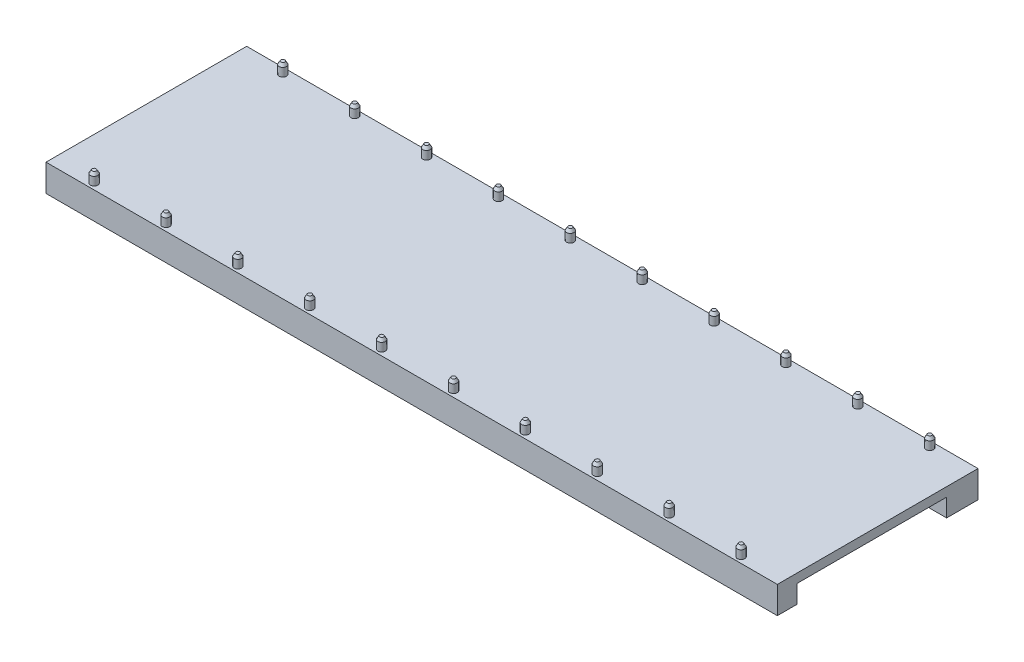
from build123d import *
from OCP.BRepFilletAPI import BRepFilletAPI_MakeChamfer

# Parameters (mm, degrees)
SKETCH1_W                   = 488.315
SKETCH1_H                   = 133.985
BOSS_EXTRUDE1_DEPTH         = 6.0452
SKETCH2_R                   = 2.4765
BOSS_EXTRUDE2_DEPTH         = 7.62
CHAMFER1_SIZE               = 2.032
CHAMFER1_SIZE2              = 1.173175747
LPATTERN1_COUNT             = 5
LPATTERN1_PITCH             = 95.9866
CHAMFER1_OF_LPATTERN1_SIZE  = 2.032
CHAMFER1_OF_LPATTERN1_SIZE2 = 1.173175747
SKETCH3_W                   = 20.955
SKETCH3_H                   = 12.065
SKETCH3_W_2                 = 13.0048
BOSS_EXTRUDE3_DEPTH         = 488.315


with BuildPart() as part:
    # Sketch1 → Boss-Extrude1 (new body)
    with BuildSketch(Plane(origin=(0, 0, 0), x_dir=(1, 0, 0), z_dir=(0, 1, 0))):
        with Locations((244.1575, -66.9925)):
            Rectangle(SKETCH1_W, SKETCH1_H)
    extrude(amount=-BOSS_EXTRUDE1_DEPTH)

    # Sketch2 → Boss-Extrude2 (add)
    with BuildSketch(Plane(origin=(0, 0, 0), x_dir=(1, 0, 0), z_dir=(0, 1, 0))):
        with Locations(Location((28.1305, -4.0005, 0), (0, 0, 90))):
            Circle(SKETCH2_R)
        with Locations(Location((76.1365, -4.0005, 0), (0, 0, 90))):
            Circle(SKETCH2_R)
        with Locations(Location((28.1305, -129.9845, 0), (0, 0, 90))):
            Circle(SKETCH2_R)
        with Locations(Location((76.1365, -129.9845, 0), (0, 0, 90))):
            Circle(SKETCH2_R)
    boss_extrude2 = extrude(amount=BOSS_EXTRUDE2_DEPTH)

    # Chamfer1: one chamfer whose edges measure the first distance from different faces: ONE call of the kernel's chamfer builder (chamfer() names one face for all edges)
    chamfer1_edges_1 = [part.edges().sort_by_distance(p)[0] for p in [
        (28.1305, 7.62, 6.477),
    ]]
    chamfer1_side_1 = [part.faces().sort_by_distance(p)[0] for p in [
        (28.1305, 3.81, 6.477),
    ]]
    chamfer1_edges_2 = [part.edges().sort_by_distance(p)[0] for p in [
        (76.1365, 7.62, 6.477),
    ]]
    chamfer1_side_2 = [part.faces().sort_by_distance(p)[0] for p in [
        (76.1365, 3.81, 6.477),
    ]]
    chamfer1_edges_3 = [part.edges().sort_by_distance(p)[0] for p in [
        (28.1305, 7.62, 132.461),
    ]]
    chamfer1_side_3 = [part.faces().sort_by_distance(p)[0] for p in [
        (28.1305, 3.81, 132.461),
    ]]
    chamfer1_edges_4 = [part.edges().sort_by_distance(p)[0] for p in [
        (76.1365, 7.62, 132.461),
    ]]
    chamfer1_side_4 = [part.faces().sort_by_distance(p)[0] for p in [
        (76.1365, 3.81, 132.461),
    ]]
    chamfer1 = BRepFilletAPI_MakeChamfer(part.part.solid().wrapped)
    for e in chamfer1_edges_1:
        chamfer1.Add(CHAMFER1_SIZE, CHAMFER1_SIZE2, e.wrapped, chamfer1_side_1[0].wrapped)  # the first distance lies on this face
    for e in chamfer1_edges_2:
        chamfer1.Add(CHAMFER1_SIZE, CHAMFER1_SIZE2, e.wrapped, chamfer1_side_2[0].wrapped)  # the first distance lies on this face
    for e in chamfer1_edges_3:
        chamfer1.Add(CHAMFER1_SIZE, CHAMFER1_SIZE2, e.wrapped, chamfer1_side_3[0].wrapped)  # the first distance lies on this face
    for e in chamfer1_edges_4:
        chamfer1.Add(CHAMFER1_SIZE, CHAMFER1_SIZE2, e.wrapped, chamfer1_side_4[0].wrapped)  # the first distance lies on this face
    add(Compound.cast(chamfer1.Shape()), mode=Mode.REPLACE)

    # LPattern1: Boss-Extrude2 ×5
    with Locations(*[(i * LPATTERN1_PITCH, 0, 0) for i in range(1, LPATTERN1_COUNT)]):
        add(boss_extrude2)

    # Chamfer1 of LPattern1: one chamfer whose edges measure the first distance from different faces: ONE call of the kernel's chamfer builder (chamfer() names one face for all edges)
    chamfer1_of_lpattern1_edges_1 = [part.edges().sort_by_distance(p)[0] for p in [
        (124.1171, 7.62, 6.477),
    ]]
    chamfer1_of_lpattern1_side_1 = [part.faces().sort_by_distance(p)[0] for p in [
        (124.1171, 3.81, 6.477),
    ]]
    chamfer1_of_lpattern1_edges_2 = [part.edges().sort_by_distance(p)[0] for p in [
        (172.1231, 7.62, 6.477),
    ]]
    chamfer1_of_lpattern1_side_2 = [part.faces().sort_by_distance(p)[0] for p in [
        (172.1231, 3.81, 6.477),
    ]]
    chamfer1_of_lpattern1_edges_3 = [part.edges().sort_by_distance(p)[0] for p in [
        (124.1171, 7.62, 132.461),
    ]]
    chamfer1_of_lpattern1_side_3 = [part.faces().sort_by_distance(p)[0] for p in [
        (124.1171, 3.81, 132.461),
    ]]
    chamfer1_of_lpattern1_edges_4 = [part.edges().sort_by_distance(p)[0] for p in [
        (172.1231, 7.62, 132.461),
    ]]
    chamfer1_of_lpattern1_side_4 = [part.faces().sort_by_distance(p)[0] for p in [
        (172.1231, 3.81, 132.461),
    ]]
    chamfer1_of_lpattern1_edges_5 = [part.edges().sort_by_distance(p)[0] for p in [
        (220.1037, 7.62, 6.477),
    ]]
    chamfer1_of_lpattern1_side_5 = [part.faces().sort_by_distance(p)[0] for p in [
        (220.1037, 3.81, 6.477),
    ]]
    chamfer1_of_lpattern1_edges_6 = [part.edges().sort_by_distance(p)[0] for p in [
        (268.1097, 7.62, 6.477),
    ]]
    chamfer1_of_lpattern1_side_6 = [part.faces().sort_by_distance(p)[0] for p in [
        (268.1097, 3.81, 6.477),
    ]]
    chamfer1_of_lpattern1_edges_7 = [part.edges().sort_by_distance(p)[0] for p in [
        (220.1037, 7.62, 132.461),
    ]]
    chamfer1_of_lpattern1_side_7 = [part.faces().sort_by_distance(p)[0] for p in [
        (220.1037, 3.81, 132.461),
    ]]
    chamfer1_of_lpattern1_edges_8 = [part.edges().sort_by_distance(p)[0] for p in [
        (268.1097, 7.62, 132.461),
    ]]
    chamfer1_of_lpattern1_side_8 = [part.faces().sort_by_distance(p)[0] for p in [
        (268.1097, 3.81, 132.461),
    ]]
    chamfer1_of_lpattern1_edges_9 = [part.edges().sort_by_distance(p)[0] for p in [
        (316.0903, 7.62, 6.477),
    ]]
    chamfer1_of_lpattern1_side_9 = [part.faces().sort_by_distance(p)[0] for p in [
        (316.0903, 3.81, 6.477),
    ]]
    chamfer1_of_lpattern1_edges_10 = [part.edges().sort_by_distance(p)[0] for p in [
        (364.0963, 7.62, 6.477),
    ]]
    chamfer1_of_lpattern1_side_10 = [part.faces().sort_by_distance(p)[0] for p in [
        (364.0963, 3.81, 6.477),
    ]]
    chamfer1_of_lpattern1_edges_11 = [part.edges().sort_by_distance(p)[0] for p in [
        (316.0903, 7.62, 132.461),
    ]]
    chamfer1_of_lpattern1_side_11 = [part.faces().sort_by_distance(p)[0] for p in [
        (316.0903, 3.81, 132.461),
    ]]
    chamfer1_of_lpattern1_edges_12 = [part.edges().sort_by_distance(p)[0] for p in [
        (364.0963, 7.62, 132.461),
    ]]
    chamfer1_of_lpattern1_side_12 = [part.faces().sort_by_distance(p)[0] for p in [
        (364.0963, 3.81, 132.461),
    ]]
    chamfer1_of_lpattern1_edges_13 = [part.edges().sort_by_distance(p)[0] for p in [
        (412.0769, 7.62, 6.477),
    ]]
    chamfer1_of_lpattern1_side_13 = [part.faces().sort_by_distance(p)[0] for p in [
        (412.0769, 3.81, 6.477),
    ]]
    chamfer1_of_lpattern1_edges_14 = [part.edges().sort_by_distance(p)[0] for p in [
        (460.0829, 7.62, 6.477),
    ]]
    chamfer1_of_lpattern1_side_14 = [part.faces().sort_by_distance(p)[0] for p in [
        (460.0829, 3.81, 6.477),
    ]]
    chamfer1_of_lpattern1_edges_15 = [part.edges().sort_by_distance(p)[0] for p in [
        (412.0769, 7.62, 132.461),
    ]]
    chamfer1_of_lpattern1_side_15 = [part.faces().sort_by_distance(p)[0] for p in [
        (412.0769, 3.81, 132.461),
    ]]
    chamfer1_of_lpattern1_edges_16 = [part.edges().sort_by_distance(p)[0] for p in [
        (460.0829, 7.62, 132.461),
    ]]
    chamfer1_of_lpattern1_side_16 = [part.faces().sort_by_distance(p)[0] for p in [
        (460.0829, 3.81, 132.461),
    ]]
    chamfer1_of_lpattern1 = BRepFilletAPI_MakeChamfer(part.part.solid().wrapped)
    for e in chamfer1_of_lpattern1_edges_1:
        chamfer1_of_lpattern1.Add(CHAMFER1_OF_LPATTERN1_SIZE, CHAMFER1_OF_LPATTERN1_SIZE2, e.wrapped, chamfer1_of_lpattern1_side_1[0].wrapped)  # the first distance lies on this face
    for e in chamfer1_of_lpattern1_edges_2:
        chamfer1_of_lpattern1.Add(CHAMFER1_OF_LPATTERN1_SIZE, CHAMFER1_OF_LPATTERN1_SIZE2, e.wrapped, chamfer1_of_lpattern1_side_2[0].wrapped)  # the first distance lies on this face
    for e in chamfer1_of_lpattern1_edges_3:
        chamfer1_of_lpattern1.Add(CHAMFER1_OF_LPATTERN1_SIZE, CHAMFER1_OF_LPATTERN1_SIZE2, e.wrapped, chamfer1_of_lpattern1_side_3[0].wrapped)  # the first distance lies on this face
    for e in chamfer1_of_lpattern1_edges_4:
        chamfer1_of_lpattern1.Add(CHAMFER1_OF_LPATTERN1_SIZE, CHAMFER1_OF_LPATTERN1_SIZE2, e.wrapped, chamfer1_of_lpattern1_side_4[0].wrapped)  # the first distance lies on this face
    for e in chamfer1_of_lpattern1_edges_5:
        chamfer1_of_lpattern1.Add(CHAMFER1_OF_LPATTERN1_SIZE, CHAMFER1_OF_LPATTERN1_SIZE2, e.wrapped, chamfer1_of_lpattern1_side_5[0].wrapped)  # the first distance lies on this face
    for e in chamfer1_of_lpattern1_edges_6:
        chamfer1_of_lpattern1.Add(CHAMFER1_OF_LPATTERN1_SIZE, CHAMFER1_OF_LPATTERN1_SIZE2, e.wrapped, chamfer1_of_lpattern1_side_6[0].wrapped)  # the first distance lies on this face
    for e in chamfer1_of_lpattern1_edges_7:
        chamfer1_of_lpattern1.Add(CHAMFER1_OF_LPATTERN1_SIZE, CHAMFER1_OF_LPATTERN1_SIZE2, e.wrapped, chamfer1_of_lpattern1_side_7[0].wrapped)  # the first distance lies on this face
    for e in chamfer1_of_lpattern1_edges_8:
        chamfer1_of_lpattern1.Add(CHAMFER1_OF_LPATTERN1_SIZE, CHAMFER1_OF_LPATTERN1_SIZE2, e.wrapped, chamfer1_of_lpattern1_side_8[0].wrapped)  # the first distance lies on this face
    for e in chamfer1_of_lpattern1_edges_9:
        chamfer1_of_lpattern1.Add(CHAMFER1_OF_LPATTERN1_SIZE, CHAMFER1_OF_LPATTERN1_SIZE2, e.wrapped, chamfer1_of_lpattern1_side_9[0].wrapped)  # the first distance lies on this face
    for e in chamfer1_of_lpattern1_edges_10:
        chamfer1_of_lpattern1.Add(CHAMFER1_OF_LPATTERN1_SIZE, CHAMFER1_OF_LPATTERN1_SIZE2, e.wrapped, chamfer1_of_lpattern1_side_10[0].wrapped)  # the first distance lies on this face
    for e in chamfer1_of_lpattern1_edges_11:
        chamfer1_of_lpattern1.Add(CHAMFER1_OF_LPATTERN1_SIZE, CHAMFER1_OF_LPATTERN1_SIZE2, e.wrapped, chamfer1_of_lpattern1_side_11[0].wrapped)  # the first distance lies on this face
    for e in chamfer1_of_lpattern1_edges_12:
        chamfer1_of_lpattern1.Add(CHAMFER1_OF_LPATTERN1_SIZE, CHAMFER1_OF_LPATTERN1_SIZE2, e.wrapped, chamfer1_of_lpattern1_side_12[0].wrapped)  # the first distance lies on this face
    for e in chamfer1_of_lpattern1_edges_13:
        chamfer1_of_lpattern1.Add(CHAMFER1_OF_LPATTERN1_SIZE, CHAMFER1_OF_LPATTERN1_SIZE2, e.wrapped, chamfer1_of_lpattern1_side_13[0].wrapped)  # the first distance lies on this face
    for e in chamfer1_of_lpattern1_edges_14:
        chamfer1_of_lpattern1.Add(CHAMFER1_OF_LPATTERN1_SIZE, CHAMFER1_OF_LPATTERN1_SIZE2, e.wrapped, chamfer1_of_lpattern1_side_14[0].wrapped)  # the first distance lies on this face
    for e in chamfer1_of_lpattern1_edges_15:
        chamfer1_of_lpattern1.Add(CHAMFER1_OF_LPATTERN1_SIZE, CHAMFER1_OF_LPATTERN1_SIZE2, e.wrapped, chamfer1_of_lpattern1_side_15[0].wrapped)  # the first distance lies on this face
    for e in chamfer1_of_lpattern1_edges_16:
        chamfer1_of_lpattern1.Add(CHAMFER1_OF_LPATTERN1_SIZE, CHAMFER1_OF_LPATTERN1_SIZE2, e.wrapped, chamfer1_of_lpattern1_side_16[0].wrapped)  # the first distance lies on this face
    add(Compound.cast(chamfer1_of_lpattern1.Shape()), mode=Mode.REPLACE)

    # Sketch3 → Boss-Extrude3 (add)
    with BuildSketch(Plane(origin=(0, 0, 0), x_dir=(0, 0, -1), z_dir=(1, 0, 0))):
        with Locations((-10.4775, -12.0777)):
            Rectangle(SKETCH3_W, SKETCH3_H)
        with Locations((-127.4826, -12.0777)):
            Rectangle(SKETCH3_W_2, SKETCH3_H)
    extrude(amount=BOSS_EXTRUDE3_DEPTH)


solid = part.part
